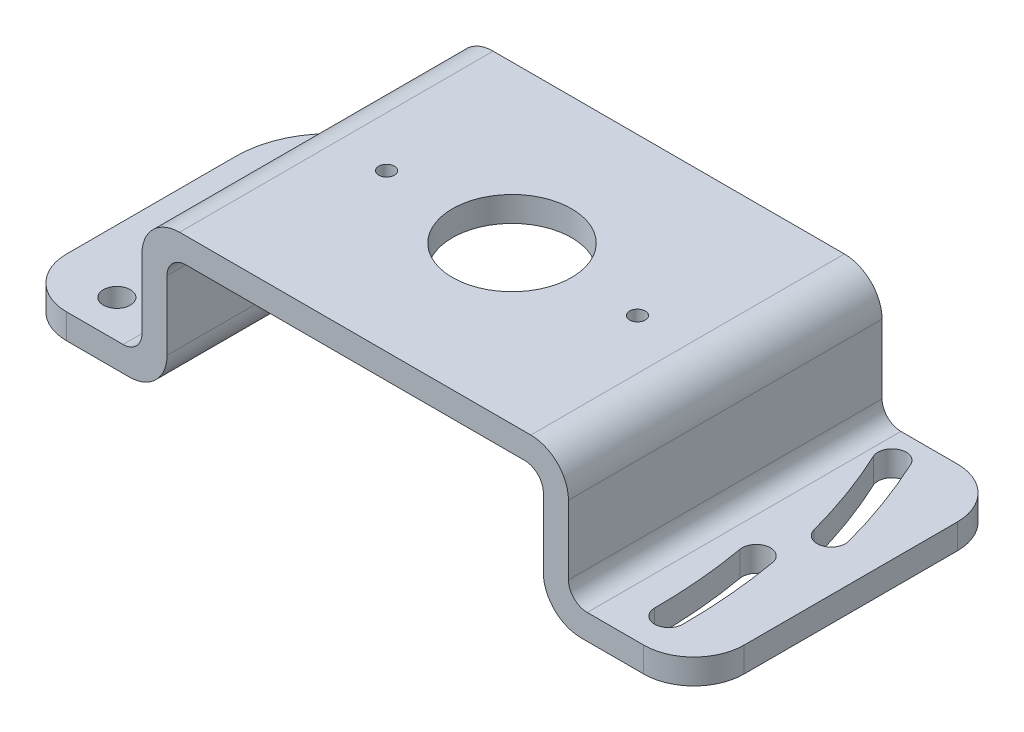
from build123d import *

# Parameters (mm, degrees)
BOSS_EXTRUDE1_DEPTH = 50
SKETCH2_R           = 9.5
CUT_EXTRUDE1_DEPTH  = 10
M3_TAPPED_HOLE1_D   = 2.5
SKETCH7_R           = 2.15
CUT_EXTRUDE2_DEPTH  = 10
FILLET1_R           = 3
FILLET2_R           = 6
FILLET3_R           = 15
FILLET4_R           = 8


with BuildPart() as part:
    # Sketch1 → Boss-Extrude1 (new body)
    with BuildSketch(Plane.XY):
        Polygon((-54, 0), (-30, 0), (-30, 20), (30, 20), (30, 0), (54, 0), (54, 4), (34, 4), (34, 24), (-34, 24), (-34, 4), (-54, 4), align=None)
    extrude(amount=BOSS_EXTRUDE1_DEPTH)

    # Sketch2 → Cut-Extrude1 (cut)
    with BuildSketch(Plane(origin=(0, 24, 0), x_dir=(1, 0, 0), z_dir=(0, 1, 0))):
        with Locations((0, -25)):
            Circle(SKETCH2_R)
    extrude(amount=-CUT_EXTRUDE1_DEPTH, mode=Mode.SUBTRACT)

    # M3 Tapped Hole1 (through all)
    with Locations(Plane(origin=(0, 24, 0), x_dir=(1, 0, 0), z_dir=(0, 1, 0))):
        with Locations((20, -25), (-20, -25)):
            Hole(M3_TAPPED_HOLE1_D / 2)

    # Sketch7 → Cut-Extrude2 (cut)
    with BuildSketch(Plane(origin=(0, 4, 0), x_dir=(1, 0, 0), z_dir=(0, 1, 0))):
        with Locations((-44, -44)):
            Circle(SKETCH7_R)
        with BuildLine():
            ThreePointArc((46.25, -44), (45.906571503, -36.134194217), (44.878899709, -28.328251966))
            ThreePointArc((44.878899709, -28.328251966), (42.272373865, -26.503142921), (40.447264821, -29.109668765))
            ThreePointArc((40.447264821, -29.109668765), (41.423695361, -36.526395059), (41.75, -44))
            ThreePointArc((41.75, -44), (44, -46.25), (46.25, -44))
        make_face()
        with BuildLine():
            ThreePointArc((48.004434954, -19.347485954), (45.50572213, -11.422581348), (42.325816715, -3.745610569))
            ThreePointArc((42.325816715, -3.745610569), (39.335733105, -2.657309137), (38.247431674, -5.647392747))
            ThreePointArc((38.247431674, -5.647392747), (41.277105336, -12.961671993), (43.657768736, -20.512171657))
            ThreePointArc((43.657768736, -20.512171657), (46.413444696, -22.103161915), (48.004434954, -19.347485954))
        make_face()
    extrude(amount=-CUT_EXTRUDE2_DEPTH, mode=Mode.SUBTRACT)

    # Fillet1
    fillet1_edges = [part.edges().sort_by_distance(p)[0] for p in [
        (34, 4, 25),
        (30, 20, 25),
        (-30, 20, 25),
        (-34, 4, 25),
    ]]
    fillet(fillet1_edges, radius=FILLET1_R)

    # Fillet2
    fillet2_edges = [part.edges().sort_by_distance(p)[0] for p in [
        (30, 0, 25),
        (34, 24, 25),
        (-30, 0, 25),
        (-34, 24, 25),
    ]]
    fillet(fillet2_edges, radius=FILLET2_R)

    # Fillet3
    fillet3_edges = [part.edges().sort_by_distance(p)[0] for p in [
        (-54, 2, 0),
    ]]
    fillet(fillet3_edges, radius=FILLET3_R)

    # Fillet4
    fillet4_edges = [part.edges().sort_by_distance(p)[0] for p in [
        (-54, 2, 50),
        (54, 2, 50),
        (54, 2, 0),
    ]]
    fillet(fillet4_edges, radius=FILLET4_R)


solid = part.part
